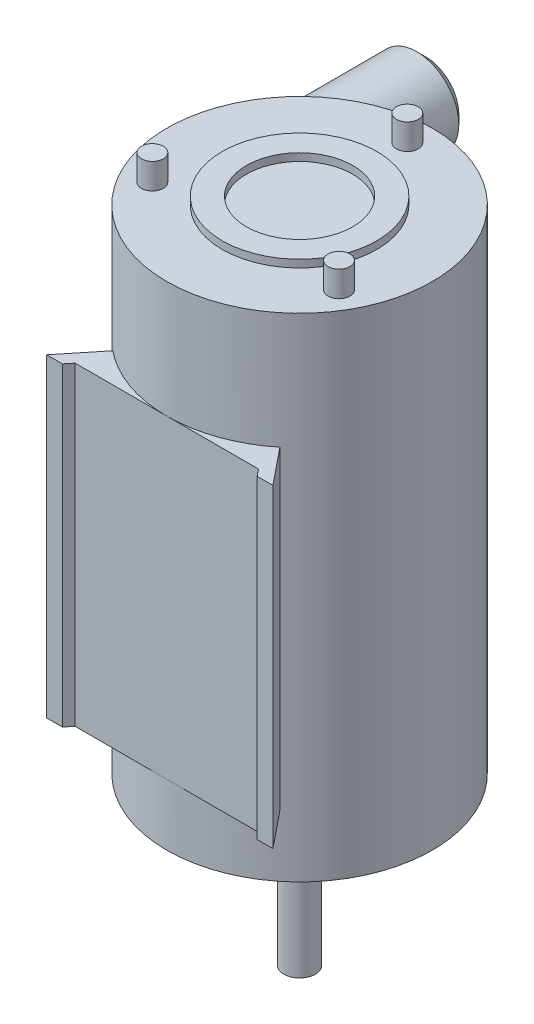
from build123d import *

# Parameters (mm, degrees)
SKETCH1_R           = 11.5824
BOSS_EXTRUDE1_DEPTH = 42.9514
SKETCH2_R           = 6.7437
SKETCH2_R_2         = 4.6355
BOSS_EXTRUDE2_DEPTH = 0.6604
SKETCH3_R           = 0.9525
BOSS_EXTRUDE3_DEPTH = 2.2352
CIRPATTERN1_COUNT   = 3
SKETCH4_R           = 3.6703
SKETCH4_R_2         = 2.4511
BOSS_EXTRUDE4_DEPTH = 18.923
CHAMFER1_SIZE       = 0.79375
SKETCH5_R           = 1.36525
BOSS_EXTRUDE5_DEPTH = 10.16
BOSS_EXTRUDE6_DEPTH = 27.432


with BuildPart() as part:
    # Sketch1 → Boss-Extrude1 (new body)
    with BuildSketch(Plane(origin=(0, 0, 0), x_dir=(1, 0, 0), z_dir=(0, 1, 0))):
        with Locations(Location((0, 0, 0), (0, 0, 270))):
            Circle(SKETCH1_R)
    extrude(amount=BOSS_EXTRUDE1_DEPTH)

    # Sketch2 → Boss-Extrude2 (add)
    with BuildSketch(Plane(origin=(0, 42.9514, 0), x_dir=(1, 0, 0), z_dir=(0, 1, 0))):
        with Locations(Location((0, 0, 0), (0, 0, 270))):
            Circle(SKETCH2_R)
        with Locations(Location((0, 0, 0), (0, 0, 270))):
            Circle(SKETCH2_R_2, mode=Mode.SUBTRACT)
    extrude(amount=BOSS_EXTRUDE2_DEPTH)

    # Sketch3 → Boss-Extrude3 (add)
    with BuildSketch(Plane(origin=(0, 42.9514, 0), x_dir=(1, 0, 0), z_dir=(0, 1, 0))):
        with Locations(Location((0, 9.398, 0), (0, 0, 270))):
            Circle(SKETCH3_R)
    boss_extrude3 = extrude(amount=BOSS_EXTRUDE3_DEPTH)

    # CirPattern1: Boss-Extrude3 ×3 about axis
    cirpattern1_axis = Axis((0, 0, 0), (0, 1, 0))
    for i in range(1, CIRPATTERN1_COUNT):
        add(boss_extrude3.rotate(cirpattern1_axis, i * 360 / CIRPATTERN1_COUNT))

    # Sketch4 → Boss-Extrude4 (add)
    with BuildSketch(Plane.XY):
        with Locations((-7.9121, 37.8333)):
            Circle(SKETCH4_R)
        with Locations((-7.9121, 37.8333)):
            Circle(SKETCH4_R_2, mode=Mode.SUBTRACT)
    extrude(amount=-BOSS_EXTRUDE4_DEPTH)

    # Chamfer1
    chamfer1_edges = [part.edges().sort_by_distance(p)[0] for p in [
        (-11.5824, 37.8333, -18.923),
    ]]
    chamfer(chamfer1_edges, length=CHAMFER1_SIZE)

    # Sketch5 → Boss-Extrude5 (add)
    with BuildSketch(Plane.XZ):
        with Locations(Location((4.318, 4.318, 0), (0, 0, 90))):
            Circle(SKETCH5_R)
    extrude(amount=BOSS_EXTRUDE5_DEPTH)

    # Sketch7 → Boss-Extrude6 (add)
    with BuildSketch(Plane(origin=(0, 32.7914, 0), x_dir=(1, 0, 0), z_dir=(0, 1, 0))):
        Polygon((0, 0), (0, -11.5824), (8.001, -11.5824), (8.494294737, -12.192), (9.865894737, -12.192), align=None)
        Polygon((-8.494294737, -12.192), (-8.001, -11.5824), (0, -11.5824), (0, 0), (-9.865894737, -12.192), align=None)
    extrude(amount=-BOSS_EXTRUDE6_DEPTH)


solid = part.part
